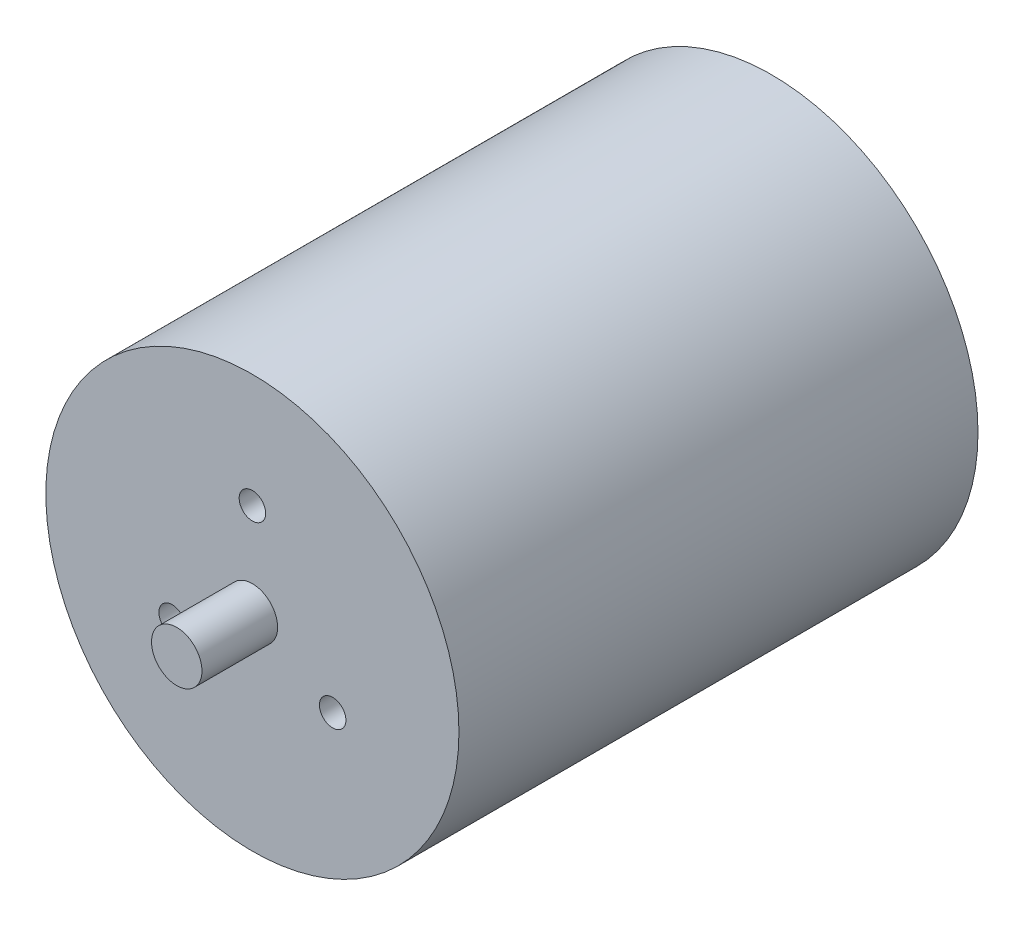
from build123d import *

# Parameters (mm, degrees)
SKETCH1_R                 = 39
BOSS_EXTRUDE1_DEPTH       = 98
SKETCH2_R                 = 4.7625
BOSS_EXTRUDE2_DEPTH       = 14.2875
M6X1_0_TAPPED_HOLE1_D     = 5
M6X1_0_TAPPED_HOLE1_DEPTH = 14.9987
M6X1_0_TAPPED_HOLE1_TIP   = 1.502151548


with BuildPart() as part:
    # Sketch1 → Boss-Extrude1 (new body)
    with BuildSketch(Plane.XY):
        Circle(SKETCH1_R)
    extrude(amount=BOSS_EXTRUDE1_DEPTH)

    # Sketch2 → Boss-Extrude2 (add)
    with BuildSketch(Plane.XY.offset(98)):
        Circle(SKETCH2_R)
    extrude(amount=BOSS_EXTRUDE2_DEPTH)

    # M6x1.0 Tapped Hole1
    with Locations(Plane.XY.offset(98)):
        with Locations((0, 17.5), (15.155444566, -8.75), (-15.155444566, -8.75)):
            Hole(M6X1_0_TAPPED_HOLE1_D / 2, depth=M6X1_0_TAPPED_HOLE1_DEPTH)
            with Locations((0, 0, -(M6X1_0_TAPPED_HOLE1_DEPTH + M6X1_0_TAPPED_HOLE1_TIP / 2))):  # 118° drill point
                Cone(0, M6X1_0_TAPPED_HOLE1_D / 2, M6X1_0_TAPPED_HOLE1_TIP, mode=Mode.SUBTRACT)


solid = part.part
